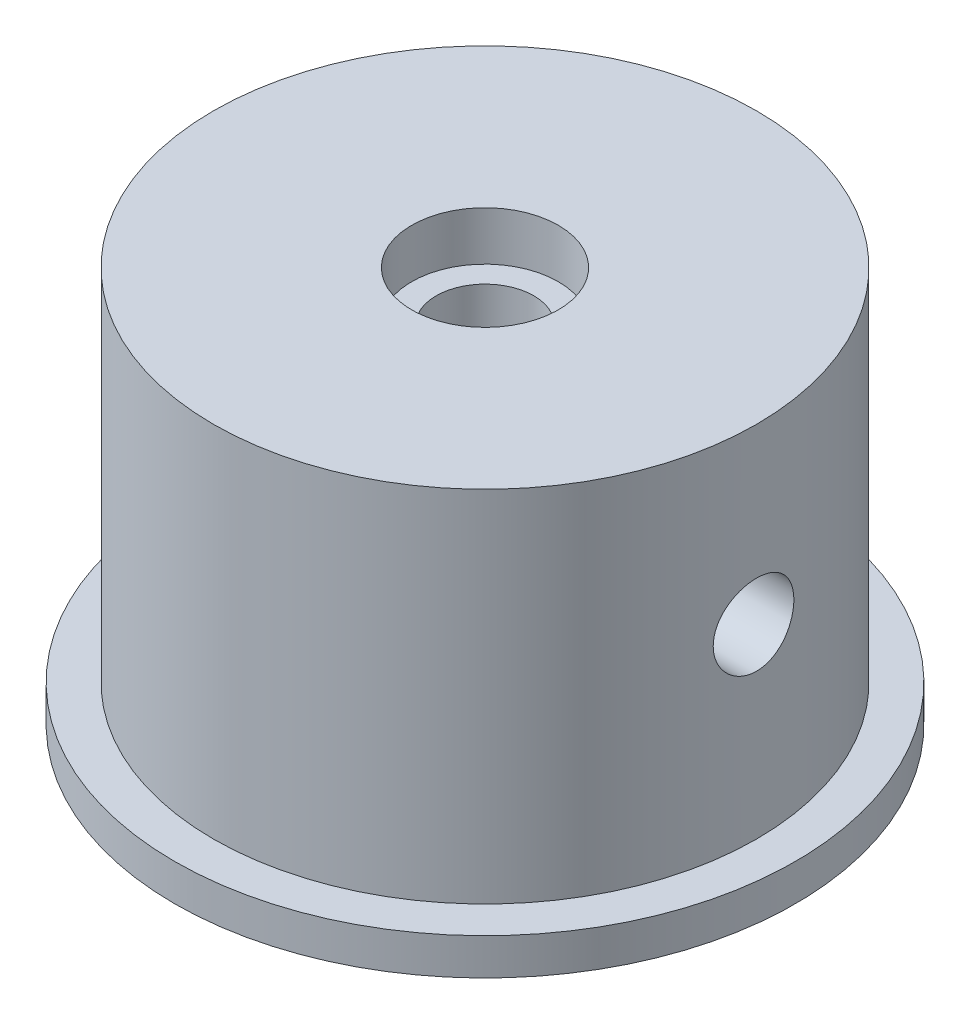
from build123d import *

# Parameters (mm, degrees)
CUT_EXTRUDE1_REACH      = 30.396
CUT_EXTRUDE1_END_RADIUS = 11.1125
CUT_EXTRUDE1_START      = -5.5
SKETCH2_R               = 1.65


with BuildPart() as part:
    # Sketch1 → Revolve1 (revolve)
    with BuildSketch(Plane(origin=(0, 0, 0), x_dir=(0, 0, -1), z_dir=(1, 0, 0)), mode=Mode.PRIVATE) as revolve1_sk:
        Polygon((-2, 0), (-3, 0), (-3, -2), (-12.7, -2), (-12.7, -0.5), (-11.1125, -0.5), (-11.1125, 14.2), (-3, 14.2), (-3, 12.2), (-2, 12.2), align=None)
    revolve(revolve1_sk.sketch.rotate(Axis((0, -1000, 0), (0, 1, 0)), 180), axis=Axis((0, -1000, 0), (0, 1, 0)))

    # Cut-Extrude1: up to this cylinder (the profile starts inside it)
    cut_extrude1_end = Plane(origin=(0, 7.1, 0), z_dir=(0, -1, 0)) * Cylinder(CUT_EXTRUDE1_END_RADIUS, 84.017, mode=Mode.PRIVATE)
    # Sketch2 → Cut-Extrude1 (cut, up to the surface)
    with BuildSketch(Plane(origin=(0, 0, 0), x_dir=(0, 0, -1), z_dir=(1, 0, 0)).offset(CUT_EXTRUDE1_START), mode=Mode.PRIVATE) as cut_extrude1_sk1:
        with Locations((0, 7.1)):
            Circle(SKETCH2_R)
    cut_extrude1_tool1 = extrude(cut_extrude1_sk1.sketch, amount=-CUT_EXTRUDE1_REACH, mode=Mode.PRIVATE) & cut_extrude1_end
    cut_extrude1 = cut_extrude1_tool1.solids().sort_by_distance((-5.5, 7.1, 0))[0]
    add(cut_extrude1, mode=Mode.SUBTRACT)

    # Mirror1: Cut-Extrude1 across plane
    add(cut_extrude1.mirror(Plane(origin=(0, 0, 0), x_dir=(0, 0, 1), z_dir=(1, 0, 0))), mode=Mode.SUBTRACT)


solid = part.part
